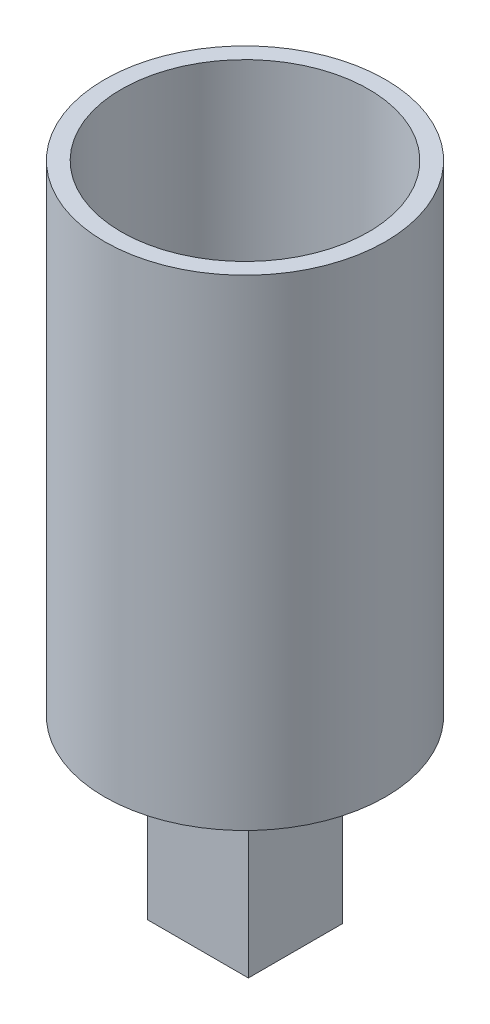
from build123d import *

# Parameters (mm, degrees)
BOSS_EXTRUDE2_START = -142.995
BOSS_EXTRUDE2_DEPTH = 142.995
BOSS_EXTRUDE3_DEPTH = 5
CUT_EXTRUDE2_REACH  = 156.714
SKETCH5_W           = 12
SKETCH5_H           = 12
SKETCH6_W           = 30
SKETCH6_H           = 28
SKETCH6_W_2         = 20
SKETCH6_H_2         = 18
BOSS_EXTRUDE4_DEPTH = 53


with BuildPart() as part:
    # Sketch3 → Boss-Extrude2 (new body)
    with BuildSketch(Plane(origin=(0, 0, 0), x_dir=(-1, 0, 0), z_dir=(0, 1, 0)).offset(BOSS_EXTRUDE2_START)):
        with BuildLine():
            ThreePointArc((-7.414110804, 41.102672806), (-36.485572351, 20.327364833), (-38.852451785, -15.325982549))
            ThreePointArc((-38.852451785, -15.325982549), (17.139485086, -38.087226229), (37.237407808, 18.914920316))
            ThreePointArc((37.237407808, 18.914920316), (18.585783578, 37.402772619), (-7.414110804, 41.102672806))
        make_face()
        with BuildLine():
            ThreePointArc((-34.201246039, -13.49123867), (-0.785346896, -36.757611208), (33.593802773, -14.939717757))
            ThreePointArc((33.593802773, -14.939717757), (13.43775935, 34.22229354), (-34.78367135, 11.909448303))
            ThreePointArc((-34.78367135, 11.909448303), (-36.756338657, -0.842804842), (-34.201246039, -13.49123867))
        make_face(mode=Mode.SUBTRACT)
    extrude(amount=BOSS_EXTRUDE2_DEPTH)

    # Sketch4 → Boss-Extrude3 (add)
    with BuildSketch(Plane.XZ.offset(142.99499992)):
        with BuildLine():
            ThreePointArc((0, 36.765999938), (-30.83028068, -20.030789916), (33.593802773, -14.939717757))
            ThreePointArc((33.593802773, -14.939717757), (30.83028068, 20.030789916), (0, 36.765999938))
        make_face()
    extrude(amount=-BOSS_EXTRUDE3_DEPTH)

    # Sketch5 → Cut-Extrude2 (cut, up to next)
    with BuildSketch(Plane.XZ.offset(142.99499992), mode=Mode.PRIVATE) as cut_extrude2_sk1:
        Rectangle(SKETCH5_W, SKETCH5_H)
    cut_extrude2_tool1 = extrude(cut_extrude2_sk1.sketch, amount=-CUT_EXTRUDE2_REACH, mode=Mode.PRIVATE) & part.part
    add(cut_extrude2_tool1.solids().sort_by_distance((0, -142.995, 0))[0], mode=Mode.SUBTRACT)

    # Sketch6 → Boss-Extrude4 (add)
    with BuildSketch(Plane.XZ.offset(142.99499992)):
        Rectangle(SKETCH6_W, SKETCH6_H)
        Rectangle(SKETCH6_W_2, SKETCH6_H_2, mode=Mode.SUBTRACT)
    extrude(amount=BOSS_EXTRUDE4_DEPTH)


solid = part.part
